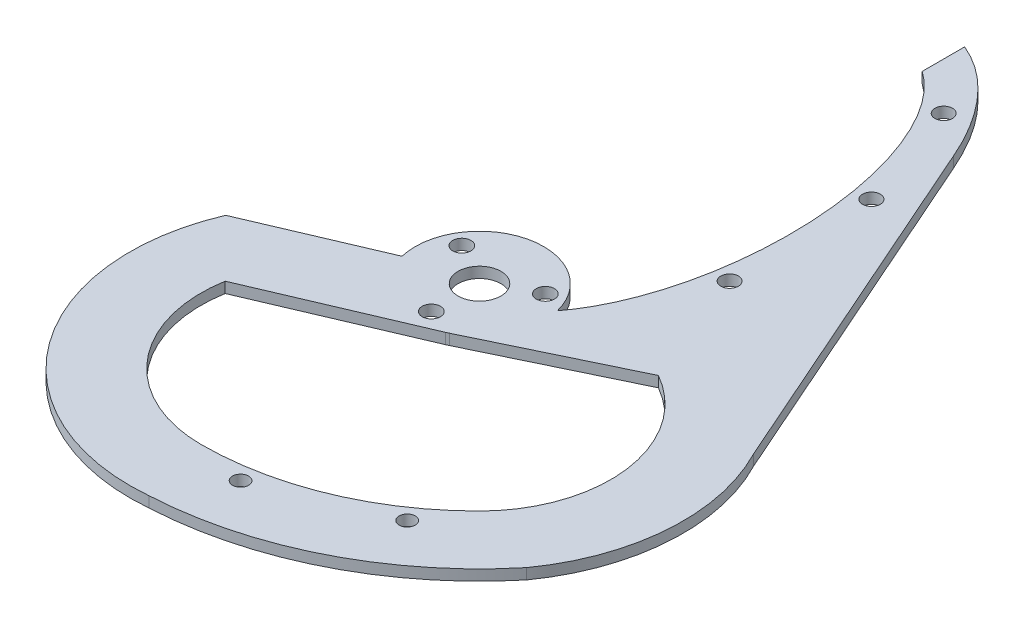
from build123d import *

# Parameters (mm, degrees)
SKETCH_1_R          = 1.5
SKETCH_1_R_2        = 4
SKETCH_1_R_3        = 1.7
EXTRUDE_1_DEPTH     = 2
SKETCH_2_R          = 1.65
CUT_EXTRUDE_1_DEPTH = 102.407591669


with BuildPart() as part:
    # Эскиз1 → Бобышка-Вытянуть1 (new body)
    with BuildSketch(Plane(origin=(0, 0, 0), x_dir=(1, 0, 0), z_dir=(0, 1, 0))):
        with BuildLine():
            Line((53.10140272, -1.919174262), (23.610564566, 64.870923375))
            add(Edge.make_bspline(
                [(23.610564566, 64.870923375), (17.392407438, 79.302147967), (7, 83.580680649)],
                knots=[2.190316087, 2.190316087, 2.190316087, 2.897805715, 2.897805715, 2.897805715], degree=2, weights=[1, 0.938082041, 1]))
            Line((7, 83.580680649), (7, 75.655170705))
            add(Edge.make_bspline(
                [(11.648024248, 2.885053055), (46.572977066, 48.339095994), (7, 75.655170705)],
                knots=[3.729556348, 3.729556348, 3.729556348, 5.943348398, 5.943348398, 5.943348398], degree=2, weights=[1, 0.447439597, 1]))
            ThreePointArc((11.648024248, 2.885053055), (-2.842752582, 11.658420037), (-11.66866221, -2.800414652))
            Line((-11.66866221, -2.800414652), (-34.753025964, -12.641731973))
            ThreePointArc((-34.753025964, -12.641731973), (-30.555954815, -49.745776402), (3.465216083, -65.136859857))
            ThreePointArc((3.465216083, -65.136859857), (29.374152775, -58.240684948), (50.320473487, -41.505038039))
            ThreePointArc((50.320473487, -41.505038039), (57.298081669, -22.104606133), (53.10140272, -1.919174262))
        make_face()
        with Locations(Location((9.550649772, -54.164426416, 0), (0, 0, 270))):
            Circle(SKETCH_1_R, mode=Mode.SUBTRACT)
        with Locations(Location((31.546703999, -45.053362436, 0), (0, 0, 90))):
            Circle(SKETCH_1_R, mode=Mode.SUBTRACT)
        with Locations(Location((0, 0, 0), (0, 0, 270))):
            Circle(SKETCH_1_R_2, mode=Mode.SUBTRACT)
        with Locations(Location((0, -9, 0), (0, 0, 270))):
            Circle(SKETCH_1_R_3, mode=Mode.SUBTRACT)
        with Locations(Location((-7.794228634, 4.5, 0), (0, 0, 270))):
            Circle(SKETCH_1_R_3, mode=Mode.SUBTRACT)
        with Locations(Location((7.794228634, 4.5, 0), (0, 0, 270))):
            Circle(SKETCH_1_R_3, mode=Mode.SUBTRACT)
        with BuildLine():
            Line((5.20136166, -10.814149845), (31.546703999, 1.857364378))
            ThreePointArc((31.546703999, 1.857364378), (43.724501128, -16.162599301), (36.769552622, -36.769552622))
            ThreePointArc((36.769552622, -36.769552622), (19.899538483, -48.041735691), (0, -52))
            ThreePointArc((0, -52), (-18.737913487, -43.284188232), (-24.14389825, -23.338008012))
            Line((-24.14389825, -23.338008012), (4.70602312, -11.038720324))
            ThreePointArc((4.70602312, -11.038720324), (4.95496481, -10.929241681), (5.20136166, -10.814149845))
        make_face(mode=Mode.SUBTRACT)
    extrude(amount=EXTRUDE_1_DEPTH)

    # Эскиз2 → Вырез-Вытянуть1 (cut, through all)
    with BuildSketch(Plane.XZ):
        with Locations(Location((22.937226804, -23.75718593, 0), (0, 0, 270))):
            Circle(SKETCH_2_R)
        with Locations(Location((15.797221102, -70.877249978, 0), (0, 0, 270))):
            Circle(SKETCH_2_R)
        with Locations(Location((22.937226804, -50.24281407, 0), (0, 0, 270))):
            Circle(SKETCH_2_R)
    extrude(amount=-CUT_EXTRUDE_1_DEPTH, mode=Mode.SUBTRACT)


solid = part.part
